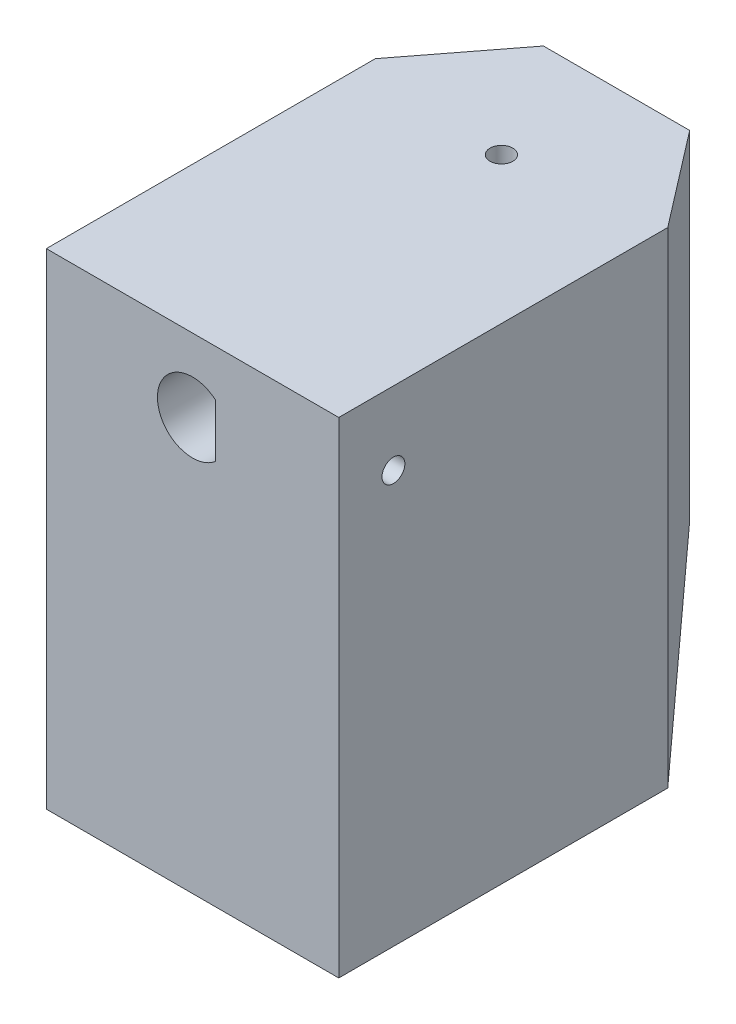
from build123d import *

# Parameters (mm, degrees)
BOSS_EXTRUDE1_DEPTH = 25.4
CUT_EXTRUDE1_DEPTH  = 9.5
SKETCH5_W           = 25.4
SKETCH5_H           = 42.164
BOSS_EXTRUDE2_DEPTH = 11.43
CUT_EXTRUDE2_REACH  = 53.538
CUT_EXTRUDE3_REACH  = 53.255
CUT_EXTRUDE4_DEPTH  = 20
SKETCH10_W          = 19.05
SKETCH10_H          = 19.05
CUT_EXTRUDE5_DEPTH  = 26.289
CUT_EXTRUDE6_REACH  = 55.322
SKETCH11_W          = 1.5875
SKETCH11_H          = 12.7
SKETCH12_R          = 0.9921875
CUT_EXTRUDE7_DEPTH  = 51.724378715
CUT_EXTRUDE8_REACH  = 52.836
SKETCH13_R          = 0.9921875


with BuildPart() as part:
    # Sketch2 → Boss-Extrude1 (new body)
    with BuildSketch(Plane.XY):
        Polygon((12.7, -6.35), (14.2875, -6.35), (14.2875, 6.35), (-14.2875, 6.35), (-14.2875, -6.35), (-12.7, -6.35), (-12.7, -35.814), (12.7, -35.814), align=None)
    extrude(amount=BOSS_EXTRUDE1_DEPTH)

    # Sketch3 → Cut-Extrude1 (cut)
    with BuildSketch(Plane.XY.offset(25.4)):
        with BuildLine():
            Line((2.003122562, 2.3), (2.003122562, -2.3))
            ThreePointArc((2.003122562, -2.3), (-3.05, 0), (2.003122562, 2.3))
        make_face()
    extrude(amount=-CUT_EXTRUDE1_DEPTH, mode=Mode.SUBTRACT)

    # Sketch5 → Boss-Extrude2 (add)
    with BuildSketch(Plane(origin=(0, 0, 0), x_dir=(-1, 0, 0), z_dir=(0, 0, -1))):
        with Locations((0, -14.732)):
            Rectangle(SKETCH5_W, SKETCH5_H)
    extrude(amount=BOSS_EXTRUDE2_DEPTH)

    # Sketch6 → Cut-Extrude2 (cut, up to next)
    with BuildSketch(Plane(origin=(12.7, 0, 0), x_dir=(0, 0, -1), z_dir=(1, 0, 0)), mode=Mode.PRIVATE) as cut_extrude2_sk1:
        Polygon((3.175, -35.814), (11.43, -23.01875), (11.43, -35.814), align=None)
    cut_extrude2_tool1 = extrude(cut_extrude2_sk1.sketch, amount=-CUT_EXTRUDE2_REACH, mode=Mode.PRIVATE) & part.part
    add(cut_extrude2_tool1.solids().sort_by_distance((12.7, -31.548917, -8.678333))[0], mode=Mode.SUBTRACT)

    # Sketch7 → Cut-Extrude3 (cut, up to next)
    with BuildSketch(Plane.XZ.offset(35.814), mode=Mode.PRIVATE) as cut_extrude3_sk1:
        Polygon((-12.7, -11.43), (-12.7, -3.175), (-6.35, -11.43), align=None)
    cut_extrude3_tool1 = extrude(cut_extrude3_sk1.sketch, amount=-CUT_EXTRUDE3_REACH, mode=Mode.PRIVATE) & part.part
    # Sketch7 → Cut-Extrude3 (cut, up to next)
    with BuildSketch(Plane.XZ.offset(35.814), mode=Mode.PRIVATE) as cut_extrude3_sk2:
        Polygon((6.35, -11.43), (12.7, -3.175), (12.7, -11.43), align=None)
    cut_extrude3_tool2 = extrude(cut_extrude3_sk2.sketch, amount=-CUT_EXTRUDE3_REACH, mode=Mode.PRIVATE) & part.part
    add(cut_extrude3_tool1.solids().sort_by_distance((-10.583333, -35.814, -8.678333))[0], mode=Mode.SUBTRACT)
    add(cut_extrude3_tool2.solids().sort_by_distance((10.583333, -35.814, -8.678333))[0], mode=Mode.SUBTRACT)

    # Sketch8 → Cut-Extrude4 (cut)
    with BuildSketch(Plane(origin=(0, 0, -11.43), x_dir=(-1, 0, 0), z_dir=(0, 0, -1))):
        with BuildLine():
            Line((-1.651, 2.859615883), (1.651, 2.859615883))
            ThreePointArc((1.651, 2.859615883), (0, -3.302), (-1.651, 2.859615883))
        make_face()
    extrude(amount=-CUT_EXTRUDE4_DEPTH, mode=Mode.SUBTRACT)

    # Sketch10 → Cut-Extrude5 (cut)
    with BuildSketch(Plane.XZ.offset(35.814)):
        with Locations((0, 12.7)):
            Rectangle(SKETCH10_W, SKETCH10_H)
    extrude(amount=-CUT_EXTRUDE5_DEPTH, mode=Mode.SUBTRACT)

    # Sketch11 → Cut-Extrude6 (cut, up to next)
    with BuildSketch(Plane.XY.offset(25.4), mode=Mode.PRIVATE) as cut_extrude6_sk1:
        with Locations((-13.49375, 0)):
            Rectangle(SKETCH11_W, SKETCH11_H)
    cut_extrude6_tool1 = extrude(cut_extrude6_sk1.sketch, amount=-CUT_EXTRUDE6_REACH, mode=Mode.PRIVATE) & part.part
    # Sketch11 → Cut-Extrude6 (cut, up to next)
    with BuildSketch(Plane.XY.offset(25.4), mode=Mode.PRIVATE) as cut_extrude6_sk2:
        with Locations((13.49375, 0)):
            Rectangle(SKETCH11_W, SKETCH11_H)
    cut_extrude6_tool2 = extrude(cut_extrude6_sk2.sketch, amount=-CUT_EXTRUDE6_REACH, mode=Mode.PRIVATE) & part.part
    add(cut_extrude6_tool1.solids().sort_by_distance((-13.49375, 0, 25.4))[0], mode=Mode.SUBTRACT)
    add(cut_extrude6_tool2.solids().sort_by_distance((13.49375, 0, 25.4))[0], mode=Mode.SUBTRACT)

    # Sketch12 → Cut-Extrude7 (cut, through all)
    with BuildSketch(Plane(origin=(12.7, 0, 0), x_dir=(0, 0, -1), z_dir=(1, 0, 0))):
        with Locations(Location((-20.65, 0, 0), (0, 0, 90))):
            Circle(SKETCH12_R)
    extrude(amount=-CUT_EXTRUDE7_DEPTH, mode=Mode.SUBTRACT)

    # Sketch13 → Cut-Extrude8 (cut, up to next)
    with BuildSketch(Plane(origin=(0, 6.35, 0), x_dir=(1, 0, 0), z_dir=(0, 1, 0)), mode=Mode.PRIVATE) as cut_extrude8_sk1:
        with Locations(Location((0, 1.43, 0), (0, 0, 180))):
            Circle(SKETCH13_R)
    cut_extrude8_tool1 = extrude(cut_extrude8_sk1.sketch, amount=-CUT_EXTRUDE8_REACH, mode=Mode.PRIVATE) & part.part
    add(cut_extrude8_tool1.solids().sort_by_distance((0, 6.35, -1.43))[0], mode=Mode.SUBTRACT)


solid = part.part
